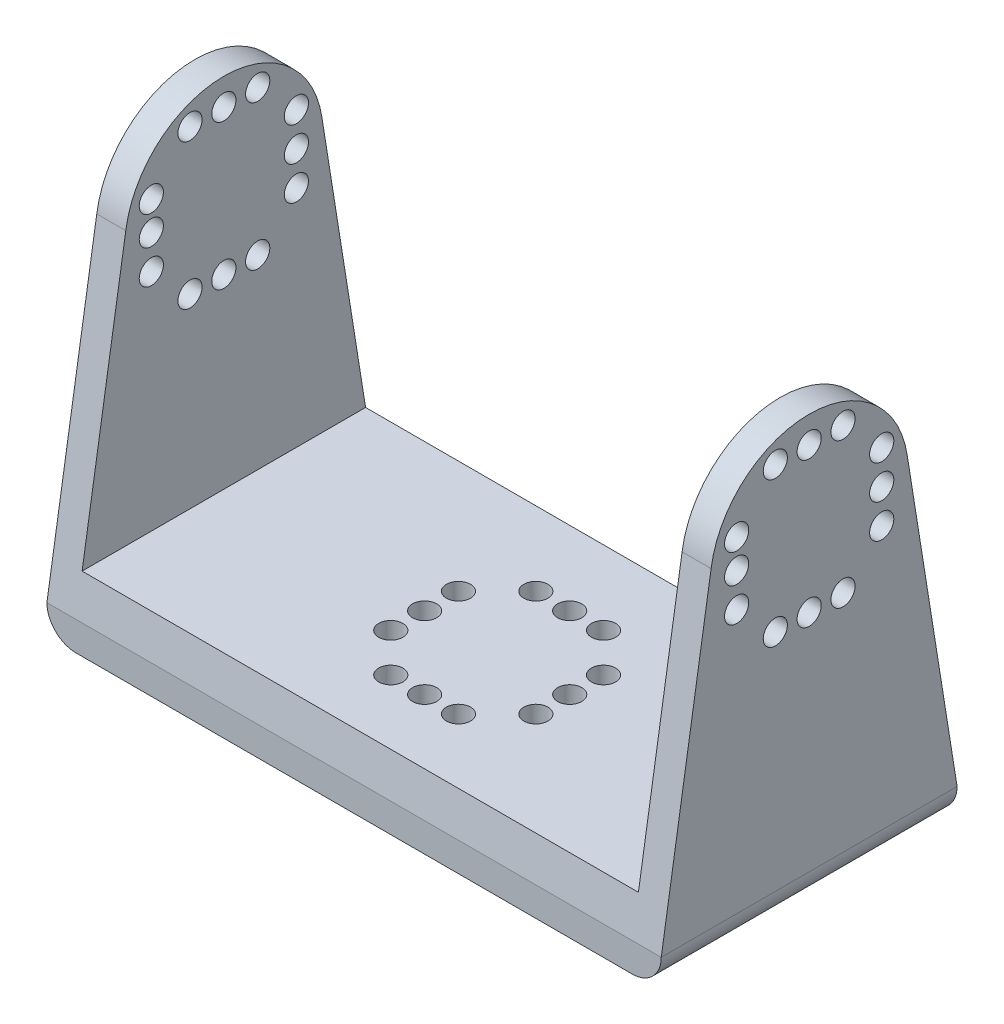
from build123d import *

# Parameters (mm, degrees)
SKETCH2_W               = 63.52
SKETCH2_H               = 30.59
BOSS_EXTRUDE1_DEPTH     = 7
SKETCH3_W               = 3
SKETCH3_H               = 30.59
BOSS_EXTRUDE2_DEPTH     = 40
FILLET2_R               = 3
SKETCH4_R               = 1.25
CUT_EXTRUDE2_DEPTH      = 70
CUT_EXTRUDE4_DEPTH      = 20
CUT_EXTRUDE4_DEPTH_BACK = 6
SKETCH7_R               = 1.25


with BuildPart() as part:
    # Sketch2 → Boss-Extrude1 (new body)
    with BuildSketch(Plane(origin=(0, 0, 0), x_dir=(1, 0, 0), z_dir=(0, 1, 0))):
        with Locations((-20.26308022, 14.924105874)):
            Rectangle(SKETCH2_W, SKETCH2_H)
    extrude(amount=BOSS_EXTRUDE1_DEPTH)

    # Sketch3 → Boss-Extrude2 (add)
    with BuildSketch(Plane(origin=(0, 7, 0), x_dir=(1, 0, 0), z_dir=(0, 1, 0))):
        with Locations((-50.52308022, 14.924105874)):
            Rectangle(SKETCH3_W, SKETCH3_H)
        with Locations((9.99691978, 14.924105874)):
            Rectangle(SKETCH3_W, SKETCH3_H)
    extrude(amount=BOSS_EXTRUDE2_DEPTH)

    # Fillet2
    fillet2_edges = [part.edges().sort_by_distance(p)[0] for p in [
        (11.49691978, 0, -14.924105874),
        (-52.02308022, 0, -14.924105874),
    ]]
    fillet(fillet2_edges, radius=FILLET2_R)

    # Sketch4 → Cut-Extrude2 (cut)
    with BuildSketch(Plane.ZY.offset(52.02308022)):
        with BuildLine():
            Line((-30.219105874, 47), (-30.219105874, 3))
            Line((-30.219105874, 3), (-25.063958288, 35.226112217))
            ThreePointArc((-25.063958288, 35.226112217), (-14.924105874, 43.987089872), (-4.784253461, 35.226112217))
            Line((-4.784253461, 35.226112217), (0.370894126, 3))
            Line((0.370894126, 3), (0.370894126, 47))
            Line((0.370894126, 47), (-30.219105874, 47))
        make_face()
        with Locations((-7.424105874, 33.73872813)):
            Circle(SKETCH4_R)
        with Locations((-7.424105874, 30.23872813)):
            Circle(SKETCH4_R)
        with Locations((-7.424105874, 36.73872813)):
            Circle(SKETCH4_R)
        with Locations((-14.924105874, 26.23872813)):
            Circle(SKETCH4_R)
        with Locations((-11.424105874, 26.23872813)):
            Circle(SKETCH4_R)
        with Locations((-18.424105874, 26.23872813)):
            Circle(SKETCH4_R)
        with Locations((-22.424105874, 33.73872813)):
            Circle(SKETCH4_R)
        with Locations((-22.424105874, 37.23872813)):
            Circle(SKETCH4_R)
        with Locations((-22.424105874, 30.23872813)):
            Circle(SKETCH4_R)
        with Locations((-11.424105874, 41.23872813)):
            Circle(SKETCH4_R)
        with Locations((-18.424105874, 41.23872813)):
            Circle(SKETCH4_R)
        with Locations((-14.924105874, 41.23872813)):
            Circle(SKETCH4_R)
    extrude(amount=-CUT_EXTRUDE2_DEPTH, mode=Mode.SUBTRACT)

    # Sketch7 → Cut-Extrude4 (cut, two sides: drawn at the far end of the back side and taken through both)
    with BuildSketch(Plane(origin=(0, 0, 0), x_dir=(1, 0, 0), z_dir=(0, 1, 0)).offset(-CUT_EXTRUDE4_DEPTH_BACK)):
        with Locations(Location((-20.263080223, 21.924105874, 0), (0, 0, 270))):
            Circle(SKETCH7_R)
        with Locations(Location((-20.263080223, 6.924105874, 0), (0, 0, 270))):
            Circle(SKETCH7_R)
        with Locations(Location((-12.763080223, 14.424105874, 0), (0, 0, 270))):
            Circle(SKETCH7_R)
        with Locations(Location((-27.763080223, 14.424105874, 0), (0, 0, 270))):
            Circle(SKETCH7_R)
        with Locations(Location((-12.763080223, 17.924105874, 0), (0, 0, 270))):
            Circle(SKETCH7_R)
        with Locations(Location((-12.763080223, 10.924105874, 0), (0, 0, 270))):
            Circle(SKETCH7_R)
        with Locations(Location((-16.763080223, 6.924105874, 0), (0, 0, 270))):
            Circle(SKETCH7_R)
        with Locations(Location((-23.763080223, 6.924105874, 0), (0, 0, 270))):
            Circle(SKETCH7_R)
        with Locations(Location((-16.763080223, 21.924105874, 0), (0, 0, 270))):
            Circle(SKETCH7_R)
        with Locations(Location((-23.763080223, 21.924105874, 0), (0, 0, 270))):
            Circle(SKETCH7_R)
        with Locations(Location((-27.763080223, 17.924105874, 0), (0, 0, 270))):
            Circle(SKETCH7_R)
        with Locations(Location((-27.763080223, 10.924105874, 0), (0, 0, 270))):
            Circle(SKETCH7_R)
    extrude(amount=CUT_EXTRUDE4_DEPTH + CUT_EXTRUDE4_DEPTH_BACK, mode=Mode.SUBTRACT)


solid = part.part
